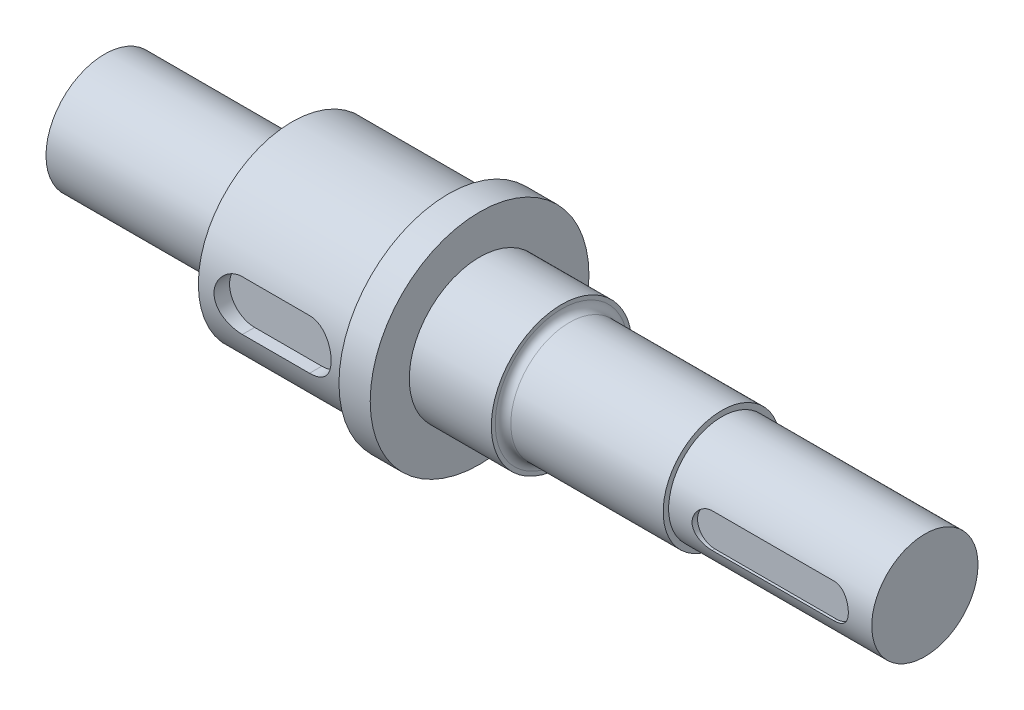
from build123d import *

# Parameters (mm, degrees)
SKETCH_1_R          = 70
EXTRUDE_1_DEPTH     = 525
SKETCH_2_OUTSIDE_W  = 254.218
SKETCH_2_OUTSIDE_H  = 254.218
SKETCH_2_OUTSIDE_R  = 45
CUT_EXTRUDE_2_DEPTH = 285
CUT_EXTRUDE_START   = -20
SKETCH_3_OUTSIDE_W  = 254.218
SKETCH_3_OUTSIDE_H  = 254.218
SKETCH_3_OUTSIDE_R  = 60
CUT_EXTRUDE_3_DEPTH = 282.703496831
SKETCH_4_OUTSIDE_W  = 254.218
SKETCH_4_OUTSIDE_H  = 254.218
SKETCH_4_OUTSIDE_R  = 37.5
CUT_EXTRUDE_4_DEPTH = 232.5
SKETCH_5_OUTSIDE_W  = 254.218
SKETCH_5_OUTSIDE_H  = 254.218
SKETCH_5_OUTSIDE_R  = 37.5
CUT_EXTRUDE_5_DEPTH = 120
CUT_EXTRUDE_START_2 = 50
CUT_EXTRUDE_6_DEPTH = 485.251813287
SKETCH_8_OUTSIDE_W  = 254.218
SKETCH_8_OUTSIDE_H  = 254.218
SKETCH_8_OUTSIDE_R  = 34
CUT_EXTRUDE_1_DEPTH = 130
CUT_EXTRUDE_START_3 = 30.5
CUT_EXTRUDE_7_DEPTH = 504.751813287
FILLET_1_R          = 5


with BuildPart() as part:
    # 草图1 → 拉伸1 (new body)
    with BuildSketch(Plane(origin=(0, 0, 0), x_dir=(0, 0, -1), z_dir=(1, 0, 0))):
        Circle(SKETCH_1_R)
    extrude(amount=EXTRUDE_1_DEPTH)

    # 草图2 outside → 拉伸2 (cut)
    with BuildSketch(Plane(origin=(525, 0, 0), x_dir=(0, 0, -1), z_dir=(1, 0, 0))):
        Rectangle(SKETCH_2_OUTSIDE_W, SKETCH_2_OUTSIDE_H)
        Circle(SKETCH_2_OUTSIDE_R, mode=Mode.SUBTRACT)
    extrude(amount=-CUT_EXTRUDE_2_DEPTH, mode=Mode.SUBTRACT)

    # 草图3 outside → 拉伸3 (cut, through all)
    with BuildSketch(Plane(origin=(240, 0, 0), x_dir=(0, 0, -1), z_dir=(1, 0, 0)).offset(CUT_EXTRUDE_START)):
        Rectangle(SKETCH_3_OUTSIDE_W, SKETCH_3_OUTSIDE_H)
        Circle(SKETCH_3_OUTSIDE_R, mode=Mode.SUBTRACT)
    extrude(amount=-CUT_EXTRUDE_3_DEPTH, mode=Mode.SUBTRACT)

    # 草图4 outside → 拉伸4 (cut)
    with BuildSketch(Plane(origin=(525, 0, 0), x_dir=(0, 0, -1), z_dir=(1, 0, 0))):
        Rectangle(SKETCH_4_OUTSIDE_W, SKETCH_4_OUTSIDE_H)
        Circle(SKETCH_4_OUTSIDE_R, mode=Mode.SUBTRACT)
    extrude(amount=-CUT_EXTRUDE_4_DEPTH, mode=Mode.SUBTRACT)

    # 草图5 outside → 拉伸5 (cut)
    with BuildSketch(Plane.ZY):
        Rectangle(SKETCH_5_OUTSIDE_W, SKETCH_5_OUTSIDE_H)
        with Locations(Location((0, 0, 0), (0, 0, 180))):
            Circle(SKETCH_5_OUTSIDE_R, mode=Mode.SUBTRACT)
    extrude(amount=-CUT_EXTRUDE_5_DEPTH, mode=Mode.SUBTRACT)

    # 草图6 → 拉伸6 (cut, through all)
    with BuildSketch(Plane.XY.offset(CUT_EXTRUDE_START_2)):
        with BuildLine():
            Line((146, 16), (189, 16))
            ThreePointArc((189, 16), (205, 0), (189, -16))
            Line((189, -16), (146, -16))
            ThreePointArc((146, -16), (130, 0), (146, 16))
        make_face()
    extrude(amount=CUT_EXTRUDE_6_DEPTH, mode=Mode.SUBTRACT)

    # 草图8 outside → 切除-拉伸1 (cut)
    with BuildSketch(Plane(origin=(525, 0, 0), x_dir=(0, 0, -1), z_dir=(1, 0, 0))):
        Rectangle(SKETCH_8_OUTSIDE_W, SKETCH_8_OUTSIDE_H)
        Circle(SKETCH_8_OUTSIDE_R, mode=Mode.SUBTRACT)
    extrude(amount=-CUT_EXTRUDE_1_DEPTH, mode=Mode.SUBTRACT)

    # 草图7 → 拉伸7 (cut, through all)
    with BuildSketch(Plane.XY.offset(CUT_EXTRUDE_START_3)):
        with BuildLine():
            Line((421, 11), (499, 11))
            ThreePointArc((499, 11), (510, 0), (499, -11))
            Line((499, -11), (421, -11))
            ThreePointArc((421, -11), (410, 0), (421, 11))
        make_face()
    extrude(amount=CUT_EXTRUDE_7_DEPTH, mode=Mode.SUBTRACT)

    # 圆角1
    fillet_1_edges = [part.edges().sort_by_distance(p)[0] for p in [
        (292.5, 0, 37.5),
        (120, 0, 37.5),
    ]]
    fillet(fillet_1_edges, radius=FILLET_1_R)


solid = part.part
